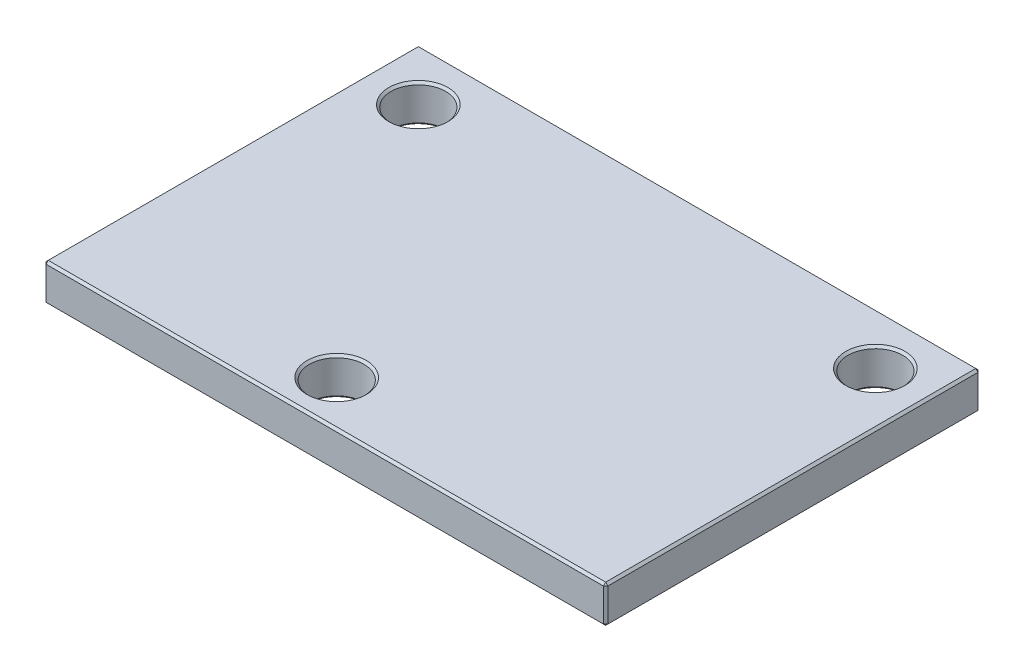
from build123d import *

# Parameters (mm, degrees)
SKETCH1_W           = 750
SKETCH1_H           = 500
BOSS_EXTRUDE1_DEPTH = 50
CUT_EXTRUDE1_REACH  = 455.459
SKETCH2_R           = 36.5
CHAMFER1_SIZE       = 3
CHAMFER2_SIZE       = 3


with BuildPart() as part:
    # Sketch1 → Boss-Extrude1 (new body)
    with BuildSketch(Plane(origin=(0, 0, 0), x_dir=(1, 0, 0), z_dir=(0, 1, 0))):
        Rectangle(SKETCH1_W, SKETCH1_H)
    extrude(amount=-BOSS_EXTRUDE1_DEPTH)

    # Sketch2 → Cut-Extrude1 (cut, up to next)
    with BuildSketch(Plane(origin=(0, 0, 0), x_dir=(1, 0, 0), z_dir=(0, 1, 0)), mode=Mode.PRIVATE) as cut_extrude1_sk1:
        with Locations(Location((-305, 180, 0), (0, 0, 270))):
            Circle(SKETCH2_R)
    cut_extrude1_tool1 = extrude(cut_extrude1_sk1.sketch, amount=-CUT_EXTRUDE1_REACH, mode=Mode.PRIVATE) & part.part
    # Sketch2 → Cut-Extrude1 (cut, up to next)
    with BuildSketch(Plane(origin=(0, 0, 0), x_dir=(1, 0, 0), z_dir=(0, 1, 0)), mode=Mode.PRIVATE) as cut_extrude1_sk2:
        with Locations(Location((305, 180, 0), (0, 0, 270))):
            Circle(SKETCH2_R)
    cut_extrude1_tool2 = extrude(cut_extrude1_sk2.sketch, amount=-CUT_EXTRUDE1_REACH, mode=Mode.PRIVATE) & part.part
    # Sketch2 → Cut-Extrude1 (cut, up to next)
    with BuildSketch(Plane(origin=(0, 0, 0), x_dir=(1, 0, 0), z_dir=(0, 1, 0)), mode=Mode.PRIVATE) as cut_extrude1_sk3:
        with Locations(Location((-44, -190, 0), (0, 0, 270))):
            Circle(SKETCH2_R)
    cut_extrude1_tool3 = extrude(cut_extrude1_sk3.sketch, amount=-CUT_EXTRUDE1_REACH, mode=Mode.PRIVATE) & part.part
    add(cut_extrude1_tool1.solids().sort_by_distance((-305, 0, -180))[0], mode=Mode.SUBTRACT)
    add(cut_extrude1_tool2.solids().sort_by_distance((305, 0, -180))[0], mode=Mode.SUBTRACT)
    add(cut_extrude1_tool3.solids().sort_by_distance((-44, 0, 190))[0], mode=Mode.SUBTRACT)

    # Chamfer1
    chamfer1_edges = [part.edges().sort_by_distance(p)[0] for p in [
        (-305, -50, -216.5),
        (-305, 0, -216.5),
        (305, -50, -216.5),
        (305, 0, -216.5),
        (-44, -50, 153.5),
        (-44, 0, 153.5),
    ]]
    chamfer(chamfer1_edges, length=CHAMFER1_SIZE)

    # Chamfer2
    chamfer2_edges = [part.edges().sort_by_distance(p)[0] for p in [
        (-375, -50, 0),
        (0, -50, 250),
        (375, -50, 0),
        (0, 0, 250),
        (-375, 0, 0),
        (0, 0, -250),
        (375, 0, 0),
        (375, -25, 250),
        (-375, -25, 250),
        (-375, -25, -250),
        (375, -25, -250),
        (0, -50, -250),
    ]]
    chamfer(chamfer2_edges, length=CHAMFER2_SIZE)


solid = part.part
